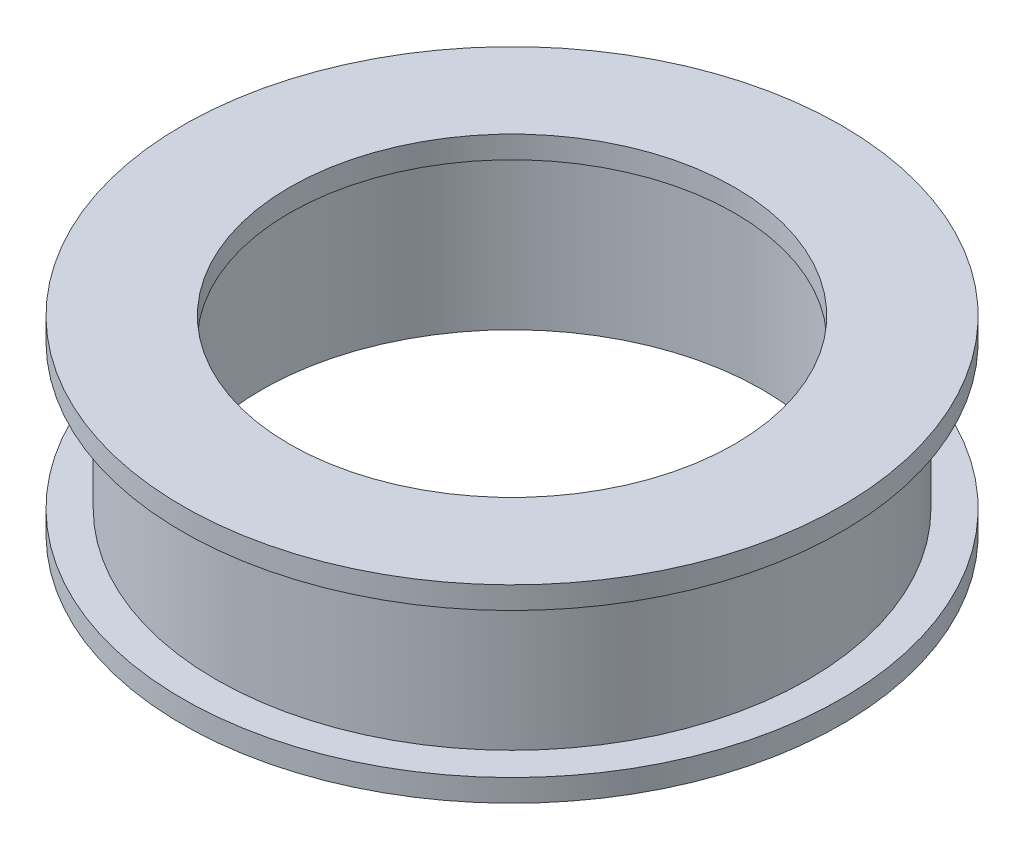
from build123d import *


with BuildPart() as part:
    # Sketch1 → Revolve1 (revolve)
    with BuildSketch(Plane.XY, mode=Mode.PRIVATE) as revolve1_sk:
        Polygon((-11.25, 0), (-14.810603006, 0), (-14.810603006, 1), (-13.310603006, 1), (-13.310603006, 7.5), (-14.810603006, 7.5), (-14.810603006, 8.5), (-10, 8.5), (-10, 7.5), (-11.25, 7.5), align=None)
    revolve(revolve1_sk.sketch.rotate(Axis((0, 0, 0), (0, 1, 0)), 270), axis=Axis((0, 0, 0), (0, 1, 0)))


solid = part.part
